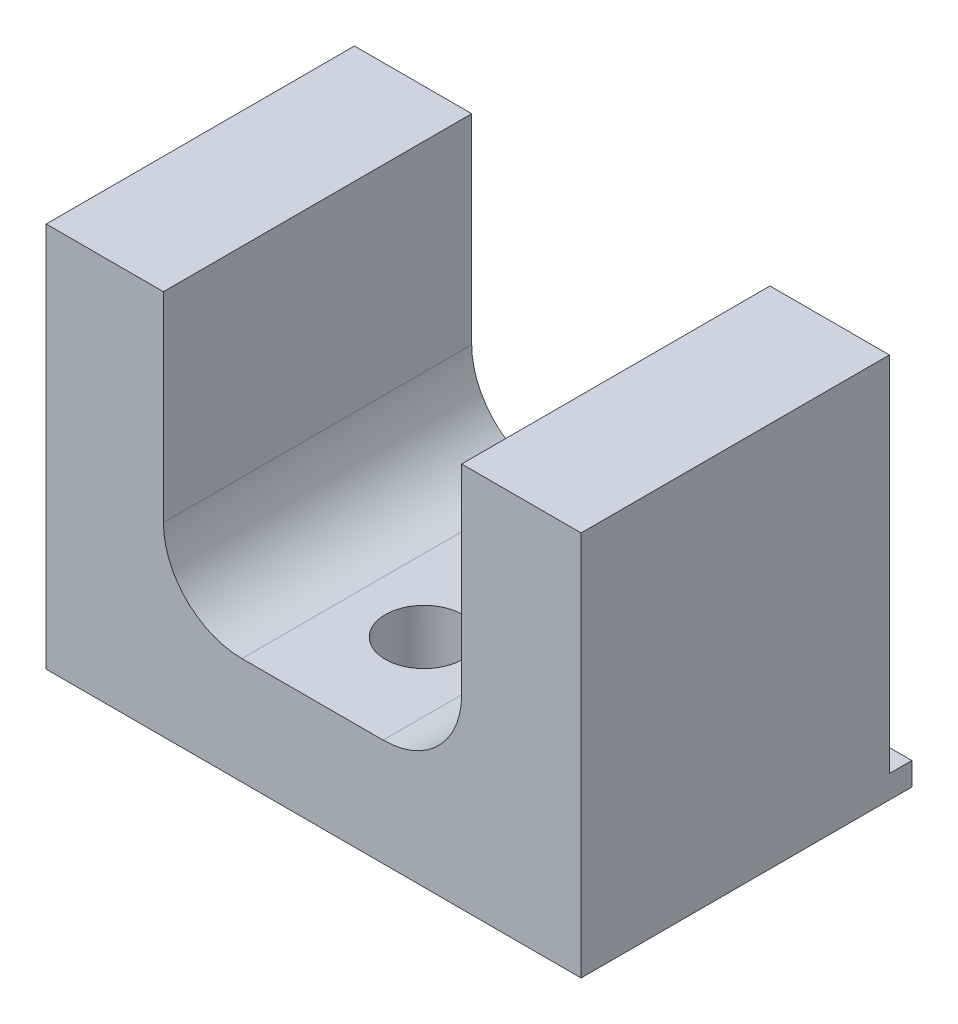
from build123d import *

# Parameters (mm, degrees)
BOSS_EXTRUDE1_DEPTH             = 45.11
CUT_EXTRUDE2_DEPTH              = 100
SKETCH3_R                       = 5.29
CUT_EXTRUDE3_DEPTH              = 100
M5X0_8_TAPPED_HOLE1_D           = 4.2
M5X0_8_TAPPED_HOLE1_DEPTH       = 27.86
M5X0_8_TAPPED_HOLE1_CSINK_D     = 5.05
M5X0_8_TAPPED_HOLE1_CSINK_ANGLE = 90
M5X0_8_TAPPED_HOLE1_TIP         = 1.2618073


with BuildPart() as part:
    # Sketch1 → Boss-Extrude1 (new body)
    with BuildSketch(Plane.XY):
        with BuildLine():
            Line((0, 0), (72.96, 0))
            Line((72.96, 0), (72.96, 52.57))
            Line((72.96, 52.57), (56.67, 52.57))
            Line((56.67, 52.57), (56.67, 25.31))
            ThreePointArc((56.67, 25.31), (53.533113627, 17.736886373), (45.96, 14.6))
            Line((45.96, 14.6), (26.7, 14.6))
            ThreePointArc((26.7, 14.6), (19.126886373, 17.736886373), (15.99, 25.31))
            Line((15.99, 25.31), (15.99, 52.58))
            Line((15.99, 52.58), (0, 52.58))
            Line((0, 52.58), (0, 0))
        make_face()
    extrude(amount=-BOSS_EXTRUDE1_DEPTH)

    # Sketch2 → Cut-Extrude2 (cut)
    with BuildSketch(Plane(origin=(72.96, 0, 0), x_dir=(0, 0, -1), z_dir=(1, 0, 0))):
        Polygon((45.11, 52.57), (45.11, 3.13), (42.05, 3.13), (42.05, 52.57), (42.05, 55.677110027), (45.11, 55.677110027), align=None)
    extrude(amount=-CUT_EXTRUDE2_DEPTH, mode=Mode.SUBTRACT)

    # Sketch3 → Cut-Extrude3 (cut)
    with BuildSketch(Plane.XZ):
        with Locations(Location((36.57, -14.97, 0), (0, 0, 270))):
            Circle(SKETCH3_R)
    extrude(amount=-CUT_EXTRUDE3_DEPTH, mode=Mode.SUBTRACT)

    # M5x0.8 Tapped Hole1
    with Locations(Plane(origin=(0, 0, -42.05), x_dir=(-1, 0, 0), z_dir=(0, 0, -1))):
        with Locations((-62.965, 42.405), (-62.965, 7.5), (-10.06, 7.5), (-10.06, 42.405)):
            CounterSinkHole(M5X0_8_TAPPED_HOLE1_D / 2, M5X0_8_TAPPED_HOLE1_CSINK_D / 2, depth=M5X0_8_TAPPED_HOLE1_DEPTH, counter_sink_angle=M5X0_8_TAPPED_HOLE1_CSINK_ANGLE)
            with Locations((0, 0, -(M5X0_8_TAPPED_HOLE1_DEPTH + M5X0_8_TAPPED_HOLE1_TIP / 2))):  # 118° drill point
                Cone(0, M5X0_8_TAPPED_HOLE1_D / 2, M5X0_8_TAPPED_HOLE1_TIP, mode=Mode.SUBTRACT)


solid = part.part
